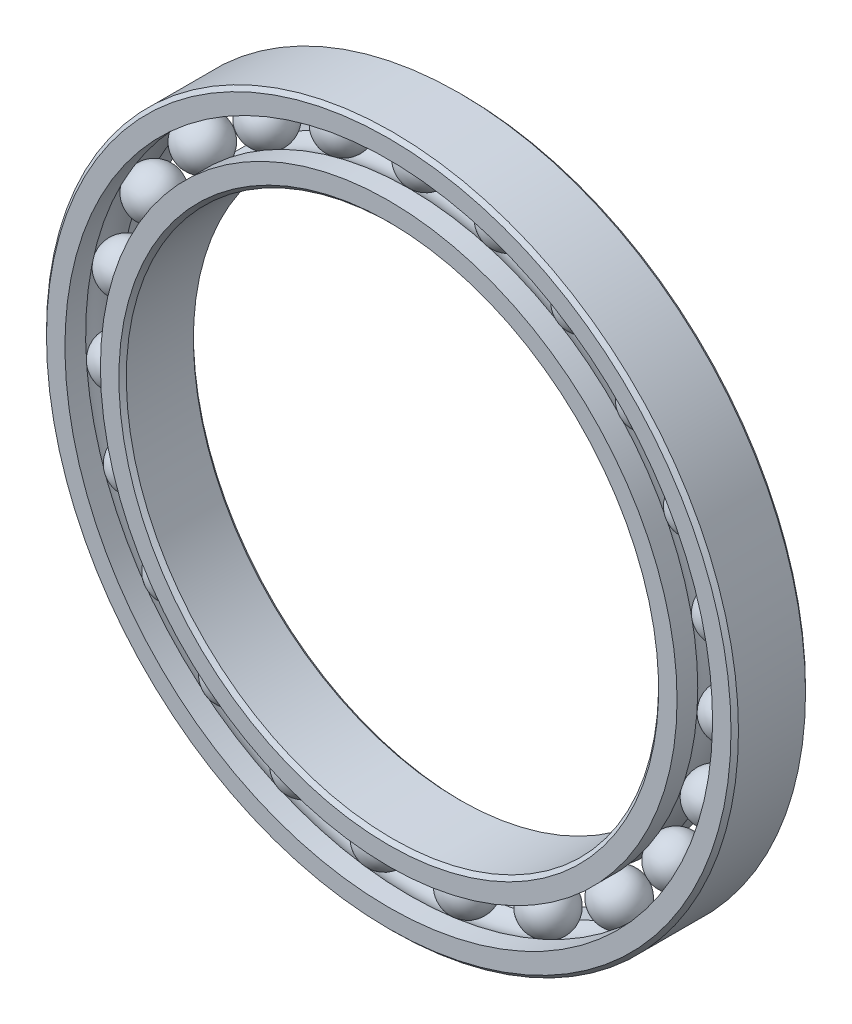
from build123d import *

# Parameters (mm, degrees)
CIRPATTERN1_COUNT = 23


with BuildPart() as part:
    # Sketch6 → Revolve5 (revolve)
    with BuildSketch(Plane(origin=(0, 0, 0), x_dir=(0, 0, -1), z_dir=(1, 0, 0)), mode=Mode.PRIVATE) as revolve5_sk:
        with BuildLine():
            Line((3.15, 32.5), (3.5, 32.15))
            Line((3.5, 32.15), (3.5, 30.416666667))
            Line((3.5, 30.416666667), (1.555555556, 30.416666667))
            ThreePointArc((1.555555556, 30.416666667), (0, 31.029809392), (-1.555555556, 30.416666667))
            Line((-1.555555556, 30.416666667), (-3.5, 30.416666667))
            Line((-3.5, 30.416666667), (-3.5, 32.15))
            Line((-3.5, 32.15), (-3.15, 32.5))
            Line((-3.15, 32.5), (3.15, 32.5))
        make_face()
    revolve(revolve5_sk.sketch.rotate(Axis((0, 0, 3.5), (0, 0, -1)), 180), axis=Axis((0, 0, 3.5), (0, 0, -1)))


with BuildPart() as body_2:
    # Sketch3 → Revolve3 (revolve)
    with BuildSketch(Plane(origin=(0, 0, 0), x_dir=(0, 0, -1), z_dir=(1, 0, 0)), mode=Mode.PRIVATE) as revolve3_sk:
        with BuildLine():
            Line((-3.5, 27.083333333), (-1.555555556, 27.083333333))
            ThreePointArc((-1.555555556, 27.083333333), (0, 26.470190608), (1.555555556, 27.083333333))
            Line((1.555555556, 27.083333333), (3.5, 27.083333333))
            Line((3.5, 27.083333333), (3.5, 25.35))
            Line((3.5, 25.35), (3.15, 25))
            Line((3.15, 25), (-3.15, 25))
            Line((-3.15, 25), (-3.5, 25.35))
            Line((-3.5, 25.35), (-3.5, 27.083333333))
        make_face()
    revolve(revolve3_sk.sketch.rotate(Axis((0, 0, 3.5), (0, 0, -1)), 180), axis=Axis((0, 0, 3.5), (0, 0, -1)))


with BuildPart() as body_3:
    # Sketch4 → Revolve4 (revolve)
    with BuildSketch(Plane(origin=(0, 0, 0), x_dir=(0, 0, -1), z_dir=(1, 0, 0))):
        with BuildLine():
            Line((-2.279809392, 28.75), (2.279809392, 28.75))
            ThreePointArc((2.279809392, 28.75), (0, 31.029809392), (-2.279809392, 28.75))
        make_face()
    revolve(axis=Axis((0, 28.75, 2.279809392), (0, 0, -1)))


with BuildPart() as cirpattern1_1:
    # CirPattern1: pattern copy
    add(body_3.part.rotate(Axis((0, 0, 0), (0, 0, 1)), 1 * 360 / CIRPATTERN1_COUNT))


with BuildPart() as cirpattern1_2:
    # CirPattern1: pattern copy
    add(body_3.part.rotate(Axis((0, 0, 0), (0, 0, 1)), 2 * 360 / CIRPATTERN1_COUNT))


with BuildPart() as cirpattern1_3:
    # CirPattern1: pattern copy
    add(body_3.part.rotate(Axis((0, 0, 0), (0, 0, 1)), 3 * 360 / CIRPATTERN1_COUNT))


with BuildPart() as cirpattern1_4:
    # CirPattern1: pattern copy
    add(body_3.part.rotate(Axis((0, 0, 0), (0, 0, 1)), 4 * 360 / CIRPATTERN1_COUNT))


with BuildPart() as cirpattern1_5:
    # CirPattern1: pattern copy
    add(body_3.part.rotate(Axis((0, 0, 0), (0, 0, 1)), 5 * 360 / CIRPATTERN1_COUNT))


with BuildPart() as cirpattern1_6:
    # CirPattern1: pattern copy
    add(body_3.part.rotate(Axis((0, 0, 0), (0, 0, 1)), 6 * 360 / CIRPATTERN1_COUNT))


with BuildPart() as cirpattern1_7:
    # CirPattern1: pattern copy
    add(body_3.part.rotate(Axis((0, 0, 0), (0, 0, 1)), 7 * 360 / CIRPATTERN1_COUNT))


with BuildPart() as cirpattern1_8:
    # CirPattern1: pattern copy
    add(body_3.part.rotate(Axis((0, 0, 0), (0, 0, 1)), 8 * 360 / CIRPATTERN1_COUNT))


with BuildPart() as cirpattern1_9:
    # CirPattern1: pattern copy
    add(body_3.part.rotate(Axis((0, 0, 0), (0, 0, 1)), 9 * 360 / CIRPATTERN1_COUNT))


with BuildPart() as cirpattern1_10:
    # CirPattern1: pattern copy
    add(body_3.part.rotate(Axis((0, 0, 0), (0, 0, 1)), 10 * 360 / CIRPATTERN1_COUNT))


with BuildPart() as cirpattern1_11:
    # CirPattern1: pattern copy
    add(body_3.part.rotate(Axis((0, 0, 0), (0, 0, 1)), 11 * 360 / CIRPATTERN1_COUNT))


with BuildPart() as cirpattern1_12:
    # CirPattern1: pattern copy
    add(body_3.part.rotate(Axis((0, 0, 0), (0, 0, 1)), 12 * 360 / CIRPATTERN1_COUNT))


with BuildPart() as cirpattern1_13:
    # CirPattern1: pattern copy
    add(body_3.part.rotate(Axis((0, 0, 0), (0, 0, 1)), 13 * 360 / CIRPATTERN1_COUNT))


with BuildPart() as cirpattern1_14:
    # CirPattern1: pattern copy
    add(body_3.part.rotate(Axis((0, 0, 0), (0, 0, 1)), 14 * 360 / CIRPATTERN1_COUNT))


with BuildPart() as cirpattern1_15:
    # CirPattern1: pattern copy
    add(body_3.part.rotate(Axis((0, 0, 0), (0, 0, 1)), 15 * 360 / CIRPATTERN1_COUNT))


with BuildPart() as cirpattern1_16:
    # CirPattern1: pattern copy
    add(body_3.part.rotate(Axis((0, 0, 0), (0, 0, 1)), 16 * 360 / CIRPATTERN1_COUNT))


with BuildPart() as cirpattern1_17:
    # CirPattern1: pattern copy
    add(body_3.part.rotate(Axis((0, 0, 0), (0, 0, 1)), 17 * 360 / CIRPATTERN1_COUNT))


with BuildPart() as cirpattern1_18:
    # CirPattern1: pattern copy
    add(body_3.part.rotate(Axis((0, 0, 0), (0, 0, 1)), 18 * 360 / CIRPATTERN1_COUNT))


with BuildPart() as cirpattern1_19:
    # CirPattern1: pattern copy
    add(body_3.part.rotate(Axis((0, 0, 0), (0, 0, 1)), 19 * 360 / CIRPATTERN1_COUNT))


with BuildPart() as cirpattern1_20:
    # CirPattern1: pattern copy
    add(body_3.part.rotate(Axis((0, 0, 0), (0, 0, 1)), 20 * 360 / CIRPATTERN1_COUNT))


with BuildPart() as cirpattern1_21:
    # CirPattern1: pattern copy
    add(body_3.part.rotate(Axis((0, 0, 0), (0, 0, 1)), 21 * 360 / CIRPATTERN1_COUNT))


with BuildPart() as cirpattern1_22:
    # CirPattern1: pattern copy
    add(body_3.part.rotate(Axis((0, 0, 0), (0, 0, 1)), 22 * 360 / CIRPATTERN1_COUNT))


solid = Compound([part.part, body_2.part, body_3.part, cirpattern1_1.part, cirpattern1_2.part, cirpattern1_3.part, cirpattern1_4.part, cirpattern1_5.part, cirpattern1_6.part, cirpattern1_7.part, cirpattern1_8.part, cirpattern1_9.part, cirpattern1_10.part, cirpattern1_11.part, cirpattern1_12.part, cirpattern1_13.part, cirpattern1_14.part, cirpattern1_15.part, cirpattern1_16.part, cirpattern1_17.part, cirpattern1_18.part, cirpattern1_19.part, cirpattern1_20.part, cirpattern1_21.part, cirpattern1_22.part])
